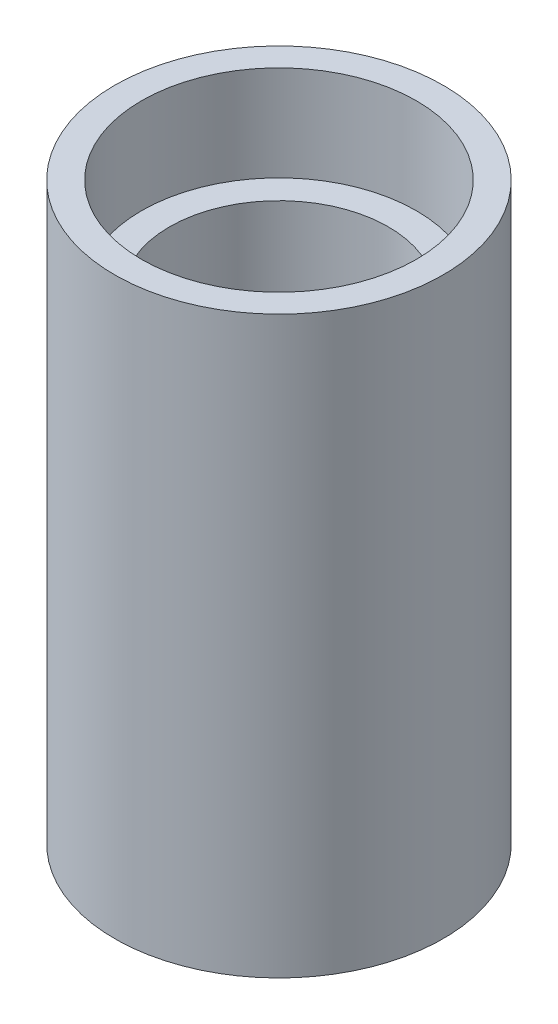
from build123d import *


with BuildPart() as part:
    # Sketch1 → Revolve1 (revolve)
    with BuildSketch(Plane.XY, mode=Mode.PRIVATE) as revolve1_sk:
        Polygon((25.4, 0), (38.1, 0), (38.1, 133.35), (31.877, 133.35), (31.877, 111.252), (25.4, 111.252), align=None)
    revolve(revolve1_sk.sketch.rotate(Axis((0, 55.746772516, 0), (0, -1, 0)), 180), axis=Axis((0, 55.746772516, 0), (0, -1, 0)))


solid = part.part
